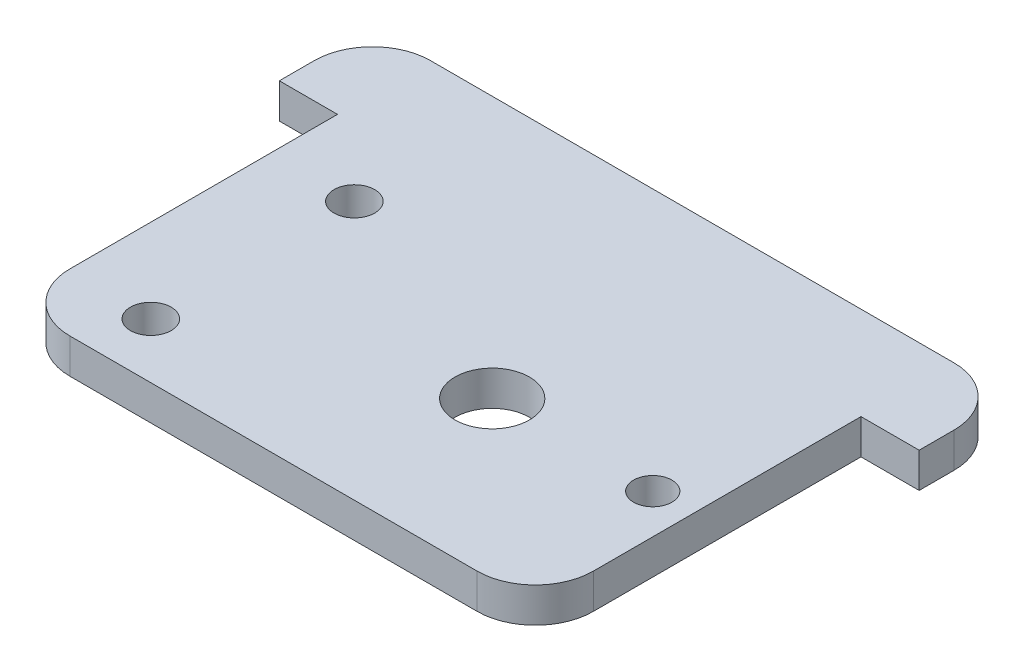
from build123d import *

# Parameters (mm, degrees)
SKETCH1_W           = 45
SKETCH1_H           = 28
SKETCH1_R           = 1.65
SKETCH1_R_2         = 3.2
SKETCH1_R_3         = 1.75
BOSS_EXTRUDE1_DEPTH = 3
FILLET1_R           = 5


with BuildPart() as part:
    # Sketch1 → Boss-Extrude1 (new body)
    # profile 1 of 2: a face of its own
    with BuildSketch(Plane(origin=(0, 0, 0), x_dir=(1, 0, 0), z_dir=(0, 1, 0))):
        Polygon((-27.5, 14), (-22.5, 14), (22.5, 14), (27.5, 14), (27.5, 22), (-27.5, 22), align=None)
    # profile 2 of 2: a face of its own
    with BuildSketch(Plane(origin=(0, 0, 0), x_dir=(1, 0, 0), z_dir=(0, 1, 0))):
        Rectangle(SKETCH1_W, SKETCH1_H)
        with Locations(Location((19.1, -0.5, 0), (0, 0, 270))):
            Circle(SKETCH1_R, mode=Mode.SUBTRACT)
        with Locations(Location((5.3, -0.5, 0), (0, 0, 270))):
            Circle(SKETCH1_R_2, mode=Mode.SUBTRACT)
        with Locations(Location((-15.3, 8.25, 0), (0, 0, 270))):
            Circle(SKETCH1_R_3, mode=Mode.SUBTRACT)
        with Locations(Location((-15.3, -9.25, 0), (0, 0, 270))):
            Circle(SKETCH1_R_3, mode=Mode.SUBTRACT)
    extrude(amount=BOSS_EXTRUDE1_DEPTH)

    # Fillet1
    fillet1_edges = [part.edges().sort_by_distance(p)[0] for p in [
        (-27.5, 1.5, -22),
        (27.5, 1.5, -22),
        (22.5, 1.5, 14),
        (-22.5, 1.5, 14),
    ]]
    fillet(fillet1_edges, radius=FILLET1_R)


solid = part.part
